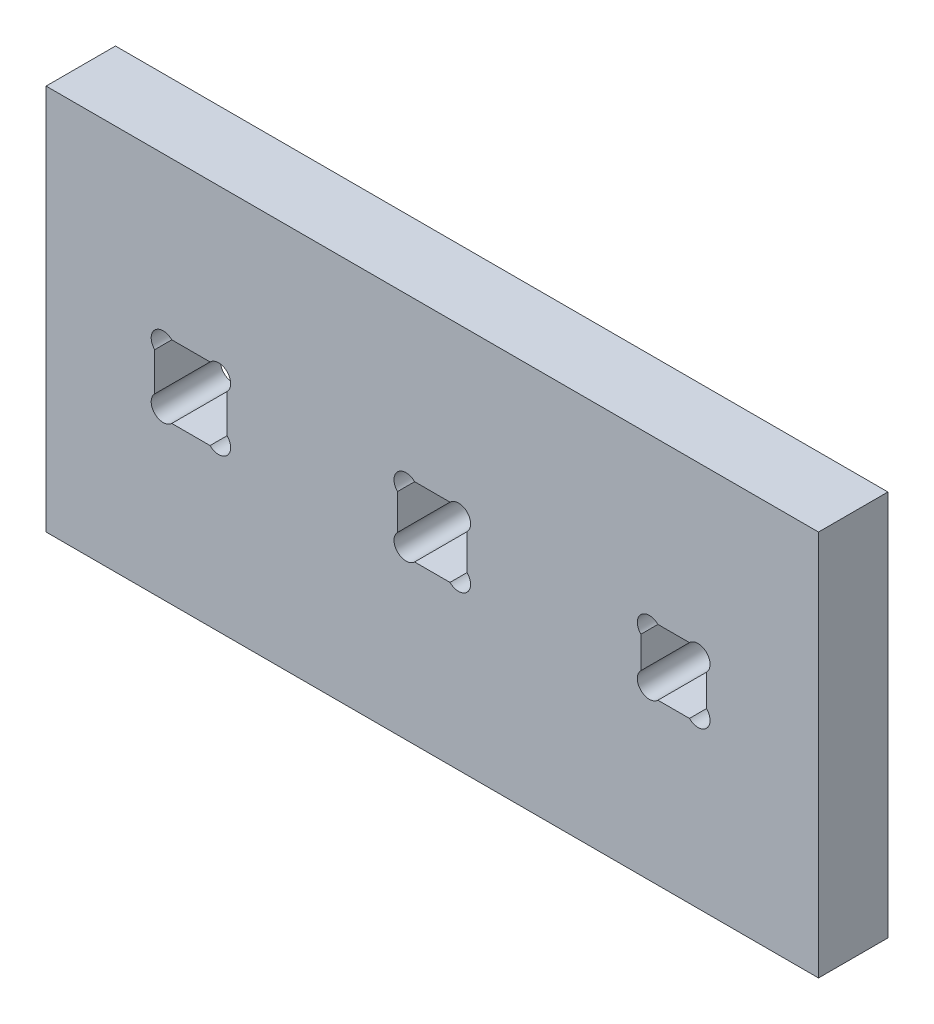
from build123d import *

# Parameters (mm, degrees)
SKETCH1_W           = 203.2
SKETCH1_H           = 101.6
BOSS_EXTRUDE1_DEPTH = 18.25625


with BuildPart() as part:
    # Sketch1 → Boss-Extrude1 (new body)
    with BuildSketch(Plane.XY):
        Rectangle(SKETCH1_W, SKETCH1_H)
        with BuildLine():
            ThreePointArc((-68.534871939, -9.525), (-70.77993597, -10.45493597), (-73.025, -9.525))
            ThreePointArc((-73.025, -9.525), (-73.95493597, -7.27993597), (-73.025, -5.034871939))
            Line((-73.025, -5.034871939), (-73.025, 5.034871939))
            ThreePointArc((-73.025, 5.034871939), (-73.95493597, 7.27993597), (-73.025, 9.525))
            ThreePointArc((-73.025, 9.525), (-70.77993597, 10.45493597), (-68.534871939, 9.525))
            Line((-68.534871939, 9.525), (-58.465128061, 9.525))
            ThreePointArc((-58.465128061, 9.525), (-56.22006403, 10.45493597), (-53.975, 9.525))
            ThreePointArc((-53.975, 9.525), (-53.04506403, 7.27993597), (-53.975, 5.034871939))
            Line((-53.975, 5.034871939), (-53.975, -5.034871939))
            ThreePointArc((-53.975, -5.034871939), (-53.04506403, -7.27993597), (-53.975, -9.525))
            ThreePointArc((-53.975, -9.525), (-56.22006403, -10.45493597), (-58.465128061, -9.525))
            Line((-58.465128061, -9.525), (-68.534871939, -9.525))
        make_face(mode=Mode.SUBTRACT)
        with BuildLine():
            ThreePointArc((-4.653871939, -9.144), (-6.89893597, -10.07393597), (-9.144, -9.144))
            ThreePointArc((-9.144, -9.144), (-10.07393597, -6.89893597), (-9.144, -4.653871939))
            Line((-9.144, -4.653871939), (-9.144, 4.653871939))
            ThreePointArc((-9.144, 4.653871939), (-10.07393597, 6.89893597), (-9.144, 9.144))
            ThreePointArc((-9.144, 9.144), (-6.89893597, 10.07393597), (-4.653871939, 9.144))
            Line((-4.653871939, 9.144), (4.653871939, 9.144))
            ThreePointArc((4.653871939, 9.144), (6.89893597, 10.07393597), (9.144, 9.144))
            ThreePointArc((9.144, 9.144), (10.07393597, 6.89893597), (9.144, 4.653871939))
            Line((9.144, 4.653871939), (9.144, -4.653871939))
            ThreePointArc((9.144, -4.653871939), (10.07393597, -6.89893597), (9.144, -9.144))
            ThreePointArc((9.144, -9.144), (6.89893597, -10.07393597), (4.653871939, -9.144))
            Line((4.653871939, -9.144), (-4.653871939, -9.144))
        make_face(mode=Mode.SUBTRACT)
        with BuildLine():
            ThreePointArc((59.354128061, -8.636), (57.10906403, -9.56593597), (54.864, -8.636))
            ThreePointArc((54.864, -8.636), (53.93406403, -6.39093597), (54.864, -4.145871939))
            Line((54.864, -4.145871939), (54.864, 4.145871939))
            ThreePointArc((54.864, 4.145871939), (53.93406403, 6.39093597), (54.864, 8.636))
            ThreePointArc((54.864, 8.636), (57.10906403, 9.56593597), (59.354128061, 8.636))
            Line((59.354128061, 8.636), (67.645871939, 8.636))
            ThreePointArc((67.645871939, 8.636), (69.89093597, 9.56593597), (72.136, 8.636))
            ThreePointArc((72.136, 8.636), (73.06593597, 6.39093597), (72.136, 4.145871939))
            Line((72.136, 4.145871939), (72.136, -4.145871939))
            ThreePointArc((72.136, -4.145871939), (73.06593597, -6.39093597), (72.136, -8.636))
            ThreePointArc((72.136, -8.636), (69.89093597, -9.56593597), (67.645871939, -8.636))
            Line((67.645871939, -8.636), (59.354128061, -8.636))
        make_face(mode=Mode.SUBTRACT)
    extrude(amount=BOSS_EXTRUDE1_DEPTH)


solid = part.part
